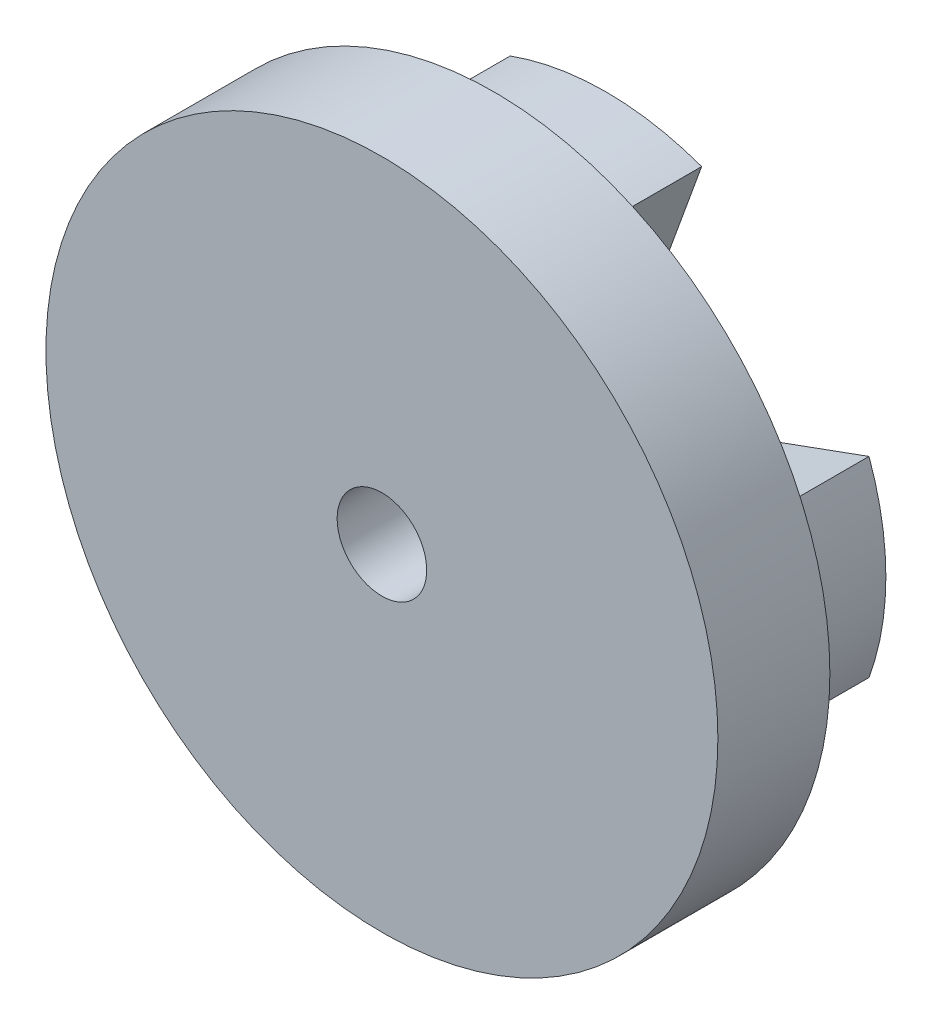
from build123d import *

# Parameters (mm, degrees)
SKETCH_1_R          = 15
EXTRUDE_1_DEPTH     = 5
EXTRUDE_2_DEPTH     = 5
SKETCH_3_R          = 2
CUT_EXTRUDE_1_DEPTH = 5


with BuildPart() as part:
    # 草图1 → 凸台-拉伸1 (new body)
    with BuildSketch(Plane.XY):
        Circle(SKETCH_1_R)
    extrude(amount=EXTRUDE_1_DEPTH)

    # 草图2 → 凸台-拉伸2 (add)
    with BuildSketch(Plane(origin=(0, 0, 0), x_dir=(-1, 0, 0), z_dir=(0, 0, -1))):
        with BuildLine():
            Line((-2.565151075, 7.047694656), (-4.275251792, 11.74615776))
            ThreePointArc((-4.275251792, 11.74615776), (0, 12.5), (4.275251792, 11.74615776))
            Line((4.275251792, 11.74615776), (2.565151075, 7.047694656))
            ThreePointArc((2.565151075, 7.047694656), (0, 7.5), (-2.565151075, 7.047694656))
        make_face()
        with BuildLine():
            Line((7.047694656, 2.565151075), (11.74615776, 4.275251792))
            ThreePointArc((11.74615776, 4.275251792), (12.5, 0), (11.74615776, -4.275251792))
            Line((11.74615776, -4.275251792), (7.047694656, -2.565151075))
            ThreePointArc((7.047694656, -2.565151075), (7.5, 0), (7.047694656, 2.565151075))
        make_face()
        with BuildLine():
            Line((2.565151075, -7.047694656), (4.275251792, -11.74615776))
            ThreePointArc((4.275251792, -11.74615776), (0, -12.5), (-4.275251792, -11.74615776))
            Line((-4.275251792, -11.74615776), (-2.565151075, -7.047694656))
            ThreePointArc((-2.565151075, -7.047694656), (0, -7.5), (2.565151075, -7.047694656))
        make_face()
        with BuildLine():
            Line((-7.047694656, -2.565151075), (-11.74615776, -4.275251792))
            ThreePointArc((-11.74615776, -4.275251792), (-12.5, 0), (-11.74615776, 4.275251792))
            Line((-11.74615776, 4.275251792), (-7.047694656, 2.565151075))
            ThreePointArc((-7.047694656, 2.565151075), (-7.5, 0), (-7.047694656, -2.565151075))
        make_face()
    extrude(amount=EXTRUDE_2_DEPTH)

    # 草图3 → 切除-拉伸1 (cut)
    with BuildSketch(Plane(origin=(0, 0, 0), x_dir=(-1, 0, 0), z_dir=(0, 0, -1))):
        Circle(SKETCH_3_R)
    extrude(amount=-CUT_EXTRUDE_1_DEPTH, mode=Mode.SUBTRACT)


solid = part.part
